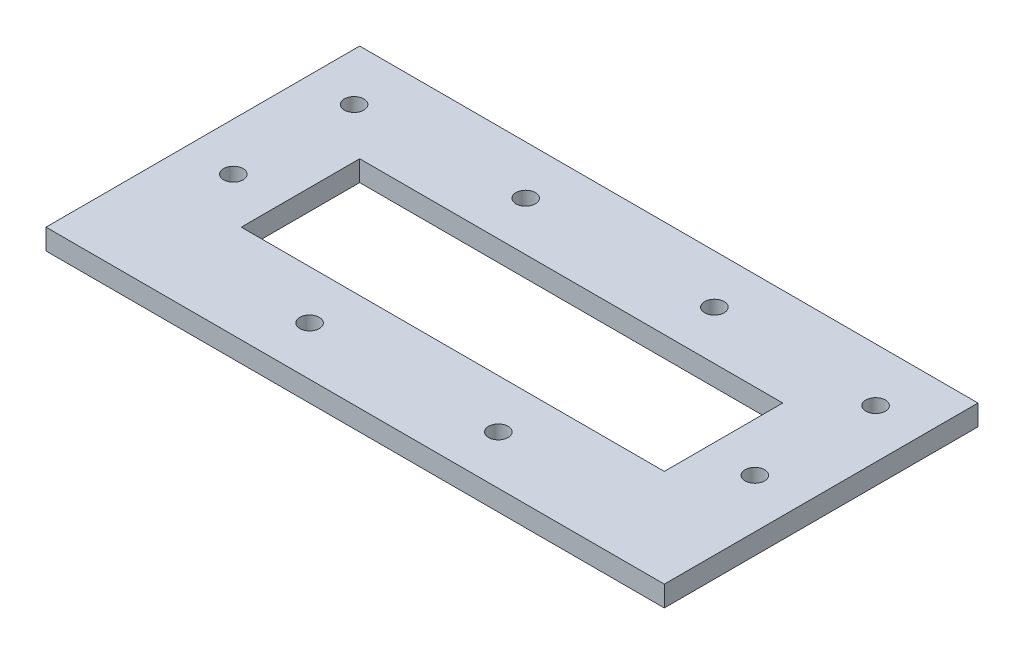
from build123d import *

# Parameters (mm, degrees)
SKETCH2_W           = 94.999999992
SKETCH2_H           = 48.197360298
SKETCH2_R           = 1.5
SKETCH2_W_2         = 64.999999992
SKETCH2_H_2         = 18.197360298
BOSS_EXTRUDE2_DEPTH = 3.175


with BuildPart() as part:
    # Sketch2 → Boss-Extrude2 (new body)
    with BuildSketch(Plane(origin=(0, 0, 0), x_dir=(1, 0, 0), z_dir=(0, 1, 0))):
        Rectangle(SKETCH2_W, SKETCH2_H)
        with Locations(Location((-14.499999996, 16.598680149, 0), (0, 0, 270))):
            Circle(SKETCH2_R, mode=Mode.SUBTRACT)
        with Locations(Location((14.499999996, 16.598680149, 0), (0, 0, 270))):
            Circle(SKETCH2_R, mode=Mode.SUBTRACT)
        with Locations(Location((-40.148974228, 15.881761887, 0), (0, 0, 270))):
            Circle(SKETCH2_R, mode=Mode.SUBTRACT)
        with Locations(Location((-40.148974228, -2.662696697, 0), (0, 0, 270))):
            Circle(SKETCH2_R, mode=Mode.SUBTRACT)
        with Locations(Location((39.978852734, 15.881761887, 0), (0, 0, 270))):
            Circle(SKETCH2_R, mode=Mode.SUBTRACT)
        with Locations(Location((39.978852734, -2.662696697, 0), (0, 0, 270))):
            Circle(SKETCH2_R, mode=Mode.SUBTRACT)
        with Locations(Location((-14.499999996, -16.598680149, 0), (0, 0, 270))):
            Circle(SKETCH2_R, mode=Mode.SUBTRACT)
        with Locations(Location((14.499999996, -16.598680149, 0), (0, 0, 270))):
            Circle(SKETCH2_R, mode=Mode.SUBTRACT)
        Rectangle(SKETCH2_W_2, SKETCH2_H_2, mode=Mode.SUBTRACT)
    extrude(amount=BOSS_EXTRUDE2_DEPTH)


solid = part.part
